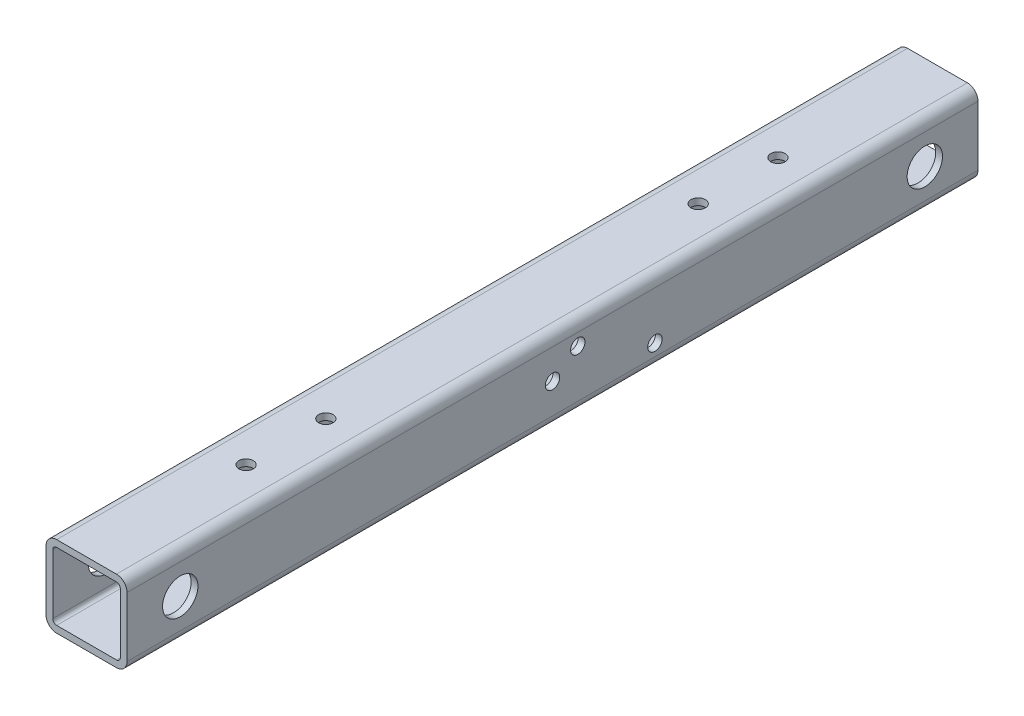
from build123d import *

# Parameters (mm, degrees)
BOSS_EXTRUDE1_DEPTH             = 400
CUT_EXTRUDE1_DEPTH              = 401.906229685
CUT_EXTRUDE1_DEPTH_BACK         = 401.906229685
SKETCH2_R                       = 8.3125
CUT_EXTRUDE2_DEPTH              = 401.906229685
CUT_EXTRUDE2_DEPTH_BACK         = 401.906229685
SKETCH3_R                       = 3.38
CUT_EXTRUDE3_DEPTH              = 401.906229685
CUT_EXTRUDE3_DEPTH_BACK         = 401.906229685
SKETCH4_R                       = 3.38
CUT_EXTRUDE4_DEPTH              = 401.906229685
CUT_EXTRUDE4_DEPTH_BACK         = 401.906229685
SKETCH5_R                       = 3.38
BROOM_MOUNTING_HOLES_DEPTH      = 401.906229685
BROOM_MOUNTING_HOLES_DEPTH_BACK = 401.906229685
SKETCH6_R                       = 3.38


with BuildPart() as part:
    # Sketch1 → Boss-Extrude1 (new body)
    with BuildSketch(Plane.XY):
        with BuildLine():
            Line((-14.05, 19.05), (14.05, 19.05))
            ThreePointArc((14.05, 19.05), (17.585533906, 17.585533906), (19.05, 14.05))
            Line((19.05, 14.05), (19.05, -14.05))
            ThreePointArc((19.05, -14.05), (17.585533906, -17.585533906), (14.05, -19.05))
            Line((14.05, -19.05), (-14.05, -19.05))
            ThreePointArc((-14.05, -19.05), (-17.585533906, -17.585533906), (-19.05, -14.05))
            Line((-19.05, -14.05), (-19.05, 14.05))
            ThreePointArc((-19.05, 14.05), (-17.585533906, 17.585533906), (-14.05, 19.05))
        make_face()
        with BuildLine():
            Line((-15.875, 14.05), (-15.875, -14.05))
            ThreePointArc((-15.875, -14.05), (-15.340469876, -15.340469876), (-14.05, -15.875))
            Line((-14.05, -15.875), (14.05, -15.875))
            ThreePointArc((14.05, -15.875), (15.340469876, -15.340469876), (15.875, -14.05))
            Line((15.875, -14.05), (15.875, 14.05))
            ThreePointArc((15.875, 14.05), (15.340469876, 15.340469876), (14.05, 15.875))
            Line((14.05, 15.875), (-14.05, 15.875))
            ThreePointArc((-14.05, 15.875), (-15.340469876, 15.340469876), (-15.875, 14.05))
        make_face(mode=Mode.SUBTRACT)
    extrude(amount=BOSS_EXTRUDE1_DEPTH)

    # Sketch2 → Cut-Extrude1 (cut, two sides: drawn at the far end of the back side and taken through both)
    with BuildSketch(Plane(origin=(0, 0, 0), x_dir=(0, 0, -1), z_dir=(1, 0, 0)).offset(-CUT_EXTRUDE1_DEPTH_BACK)):
        with Locations((-375, 0)):
            Circle(SKETCH2_R)
        with Locations((-25, 0)):
            Circle(SKETCH2_R)
    extrude(amount=CUT_EXTRUDE1_DEPTH + CUT_EXTRUDE1_DEPTH_BACK, mode=Mode.SUBTRACT)

    # Sketch3 → Cut-Extrude2 (cut, two sides: drawn at the far end of the back side and taken through both)
    with BuildSketch(Plane(origin=(0, 0, 0), x_dir=(1, 0, 0), z_dir=(0, 1, 0)).offset(-CUT_EXTRUDE2_DEPTH_BACK)):
        with Locations(Location((0, -325, 0), (0, 0, 90))):
            Circle(SKETCH3_R)
        with Locations(Location((0, -75, 0), (0, 0, 90))):
            Circle(SKETCH3_R)
    extrude(amount=CUT_EXTRUDE2_DEPTH + CUT_EXTRUDE2_DEPTH_BACK, mode=Mode.SUBTRACT)

    # Sketch4 → Cut-Extrude3 (cut, two sides: drawn at the far end of the back side and taken through both)
    with BuildSketch(Plane(origin=(0, 0, 0), x_dir=(0, 0, -1), z_dir=(1, 0, 0)).offset(-CUT_EXTRUDE3_DEPTH_BACK)):
        with Locations((-200, 0)):
            Circle(SKETCH4_R)
    extrude(amount=CUT_EXTRUDE3_DEPTH + CUT_EXTRUDE3_DEPTH_BACK, mode=Mode.SUBTRACT)

    # Sketch5 → Cut-Extrude4 (cut, two sides: drawn at the far end of the back side and taken through both)
    with BuildSketch(Plane(origin=(0, 0, 0), x_dir=(0, 0, -1), z_dir=(1, 0, 0)).offset(-CUT_EXTRUDE4_DEPTH_BACK)):
        with Locations((-188.126155741, 8.452365235)):
            Circle(SKETCH5_R)
        with Locations((-151.873844259, -8.452365235)):
            Circle(SKETCH5_R)
    extrude(amount=CUT_EXTRUDE4_DEPTH + CUT_EXTRUDE4_DEPTH_BACK, mode=Mode.SUBTRACT)

    # Sketch6 → Broom Mounting Holes (cut, two sides: drawn at the far end of the back side and taken through both)
    with BuildSketch(Plane(origin=(0, 0, 0), x_dir=(1, 0, 0), z_dir=(0, 1, 0)).offset(-BROOM_MOUNTING_HOLES_DEPTH_BACK)):
        with Locations(Location((0, -112.5, 0), (0, 0, 270))):
            Circle(SKETCH6_R)
        with Locations(Location((0, -287.5, 0), (0, 0, 270))):
            Circle(SKETCH6_R)
    extrude(amount=BROOM_MOUNTING_HOLES_DEPTH + BROOM_MOUNTING_HOLES_DEPTH_BACK, mode=Mode.SUBTRACT)


solid = part.part
